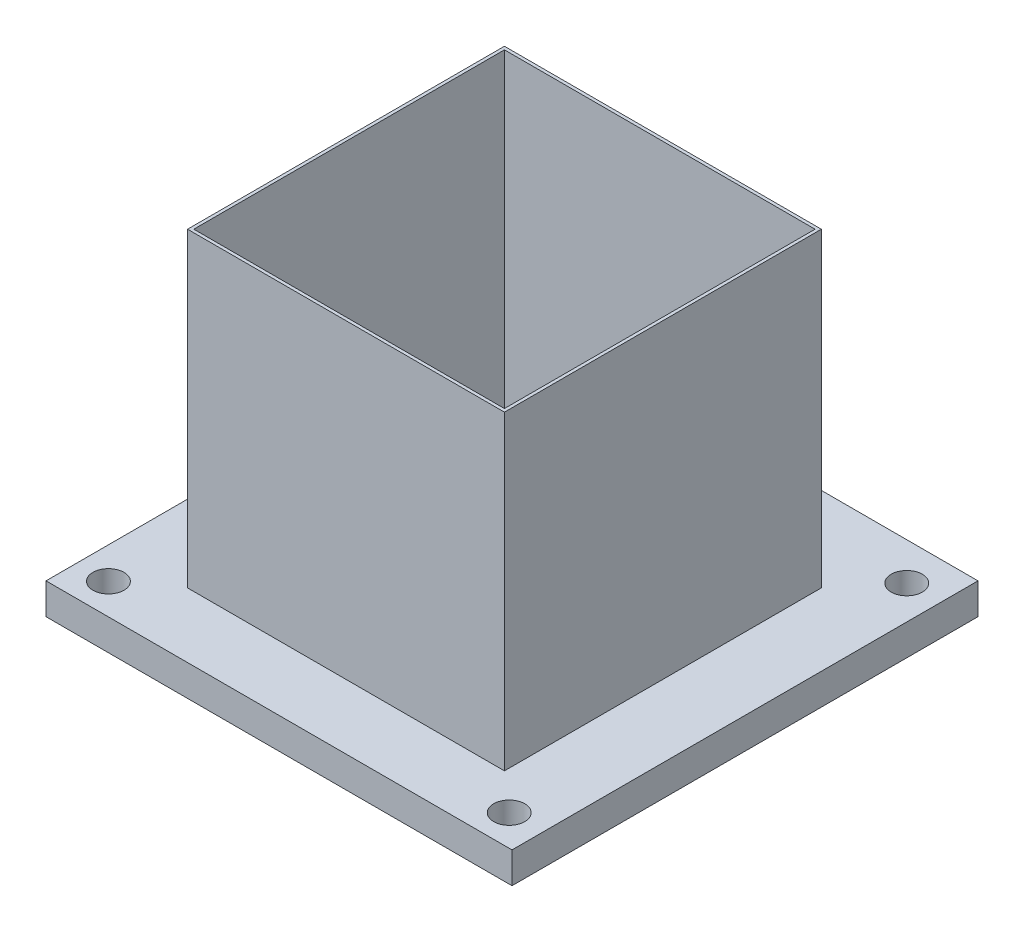
from build123d import *

# Parameters (mm, degrees)
SKETCH1_W           = 38.1
SKETCH1_H           = 38.1
SKETCH1_R           = 1.27
SKETCH1_W_2         = 25.4
SKETCH1_H_2         = 25.4
BOSS_EXTRUDE2_DEPTH = 2.54
SKETCH3_W           = 25.908
SKETCH3_H           = 25.908
SKETCH3_W_2         = 25.4
SKETCH3_H_2         = 25.4
BOSS_EXTRUDE4_DEPTH = 25.4


with BuildPart() as part:
    # Sketch1 → Boss-Extrude2 (new body)
    with BuildSketch(Plane(origin=(0, 0, 0), x_dir=(1, 0, 0), z_dir=(0, 1, 0))):
        with Locations((19.05, 19.05)):
            Rectangle(SKETCH1_W, SKETCH1_H)
        with Locations(Location((2.584718537, 35.02298259, 0), (0, 0, 270))):
            Circle(SKETCH1_R, mode=Mode.SUBTRACT)
        with Locations(Location((35.350956252, 35.02298259, 0), (0, 0, 270))):
            Circle(SKETCH1_R, mode=Mode.SUBTRACT)
        with Locations(Location((2.584718537, 2.5204018, 0), (0, 0, 270))):
            Circle(SKETCH1_R, mode=Mode.SUBTRACT)
        with Locations(Location((35.350956252, 2.5204018, 0), (0, 0, 270))):
            Circle(SKETCH1_R, mode=Mode.SUBTRACT)
        with Locations((19.241768868, 18.2395028)):
            Rectangle(SKETCH1_W_2, SKETCH1_H_2, mode=Mode.SUBTRACT)
    extrude(amount=BOSS_EXTRUDE2_DEPTH)

    # Sketch3 → Boss-Extrude4 (add)
    with BuildSketch(Plane(origin=(0, 2.54, 0), x_dir=(1, 0, 0), z_dir=(0, 1, 0))):
        with Locations((19.241768868, 18.2395028)):
            Rectangle(SKETCH3_W, SKETCH3_H)
        with Locations((19.241768868, 18.2395028)):
            Rectangle(SKETCH3_W_2, SKETCH3_H_2, mode=Mode.SUBTRACT)
    extrude(amount=BOSS_EXTRUDE4_DEPTH)


solid = part.part
